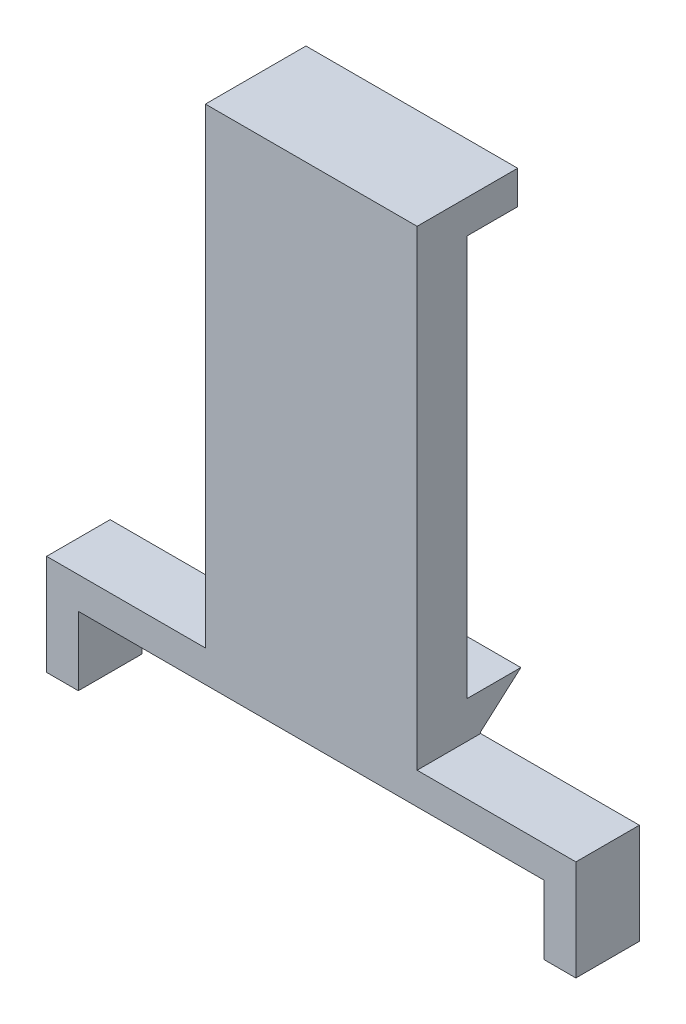
from build123d import *

# Parameters (mm, degrees)
BOSS_EXTRUDE1_DEPTH = 20
SKETCH2_W           = 30
SKETCH2_H           = 6
BOSS_EXTRUDE2_DEPTH = 3
SKETCH3_W           = 50
SKETCH3_H           = 3
BOSS_EXTRUDE3_DEPTH = 6
SKETCH4_W           = 3
SKETCH4_H           = 6
BOSS_EXTRUDE4_DEPTH = 6.5


with BuildPart() as part:
    # Sketch1 → Boss-Extrude1 (new body)
    with BuildSketch(Plane(origin=(0, 0, 0), x_dir=(0, 0, -1), z_dir=(1, 0, 0))):
        Polygon((-9.8, -6.5), (-3.8, -6.5), (-3.8, -3.357082066), (0, 0), (-5.1, 0), (-5.1, 37.85), (-0.3, 37.85), (-0.3, 41), (-9.8, 41), align=None)
    extrude(amount=BOSS_EXTRUDE1_DEPTH)

    # Sketch2 → Boss-Extrude2 (add)
    with BuildSketch(Plane.XZ.offset(6.5)):
        with Locations((10, 6.8)):
            Rectangle(SKETCH2_W, SKETCH2_H)
    extrude(amount=-BOSS_EXTRUDE2_DEPTH)

    # Sketch3 → Boss-Extrude3 (add)
    with BuildSketch(Plane(origin=(0, 0, 3.8), x_dir=(-1, 0, 0), z_dir=(0, 0, -1))):
        with Locations((-10, -5)):
            Rectangle(SKETCH3_W, SKETCH3_H)
    extrude(amount=-BOSS_EXTRUDE3_DEPTH)

    # Sketch4 → Boss-Extrude4 (add)
    with BuildSketch(Plane.XZ.offset(6.5)):
        with Locations((-13.5, 6.8)):
            Rectangle(SKETCH4_W, SKETCH4_H)
        with Locations((33.5, 6.8)):
            Rectangle(SKETCH4_W, SKETCH4_H)
    extrude(amount=BOSS_EXTRUDE4_DEPTH)


solid = part.part
